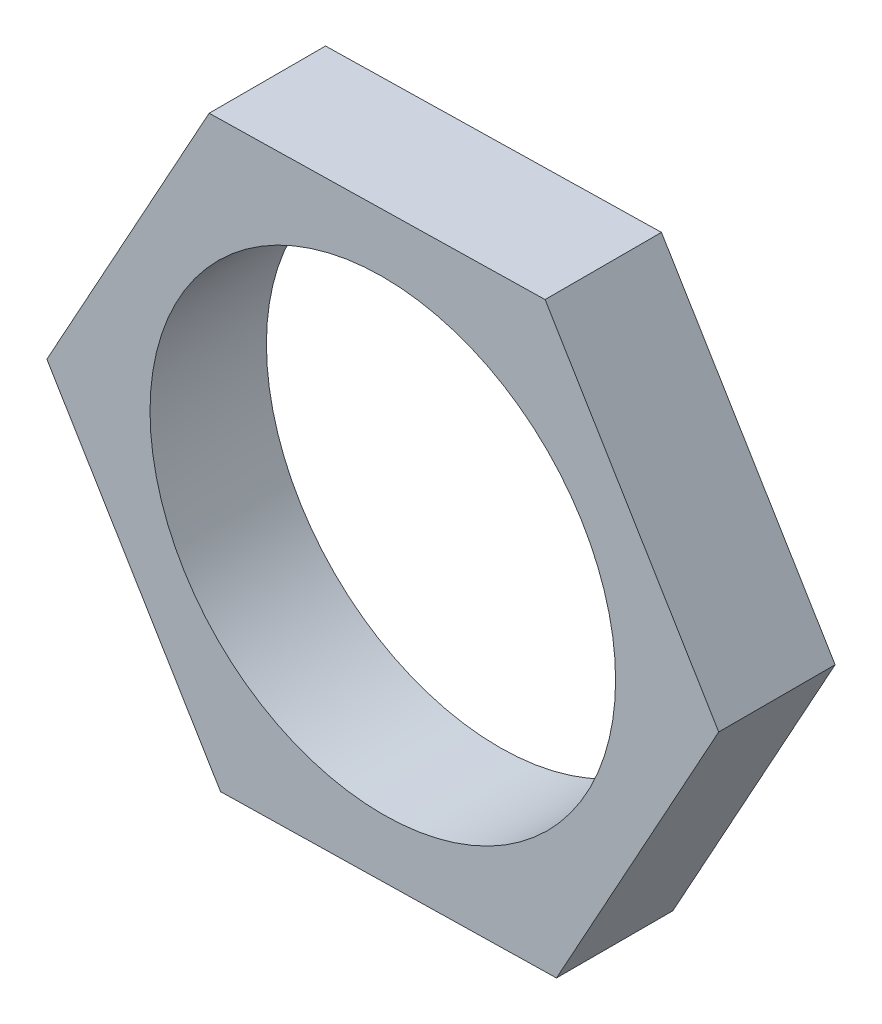
from build123d import *

# Parameters (mm, degrees)
SKETCH1_R           = 25.4
BOSS_EXTRUDE1_DEPTH = 12.7


with BuildPart() as part:
    # Sketch1 → Boss-Extrude1 (new body)
    with BuildSketch(Plane.XY):
        Polygon((17.706386542, 32.102448644), (-18.948342778, 31.385404877), (-36.654729321, -0.717043767), (-17.706386542, -32.102448644), (18.948342778, -31.385404877), (36.654729321, 0.717043767), align=None)
        Circle(SKETCH1_R, mode=Mode.SUBTRACT)
    extrude(amount=BOSS_EXTRUDE1_DEPTH)


solid = part.part
